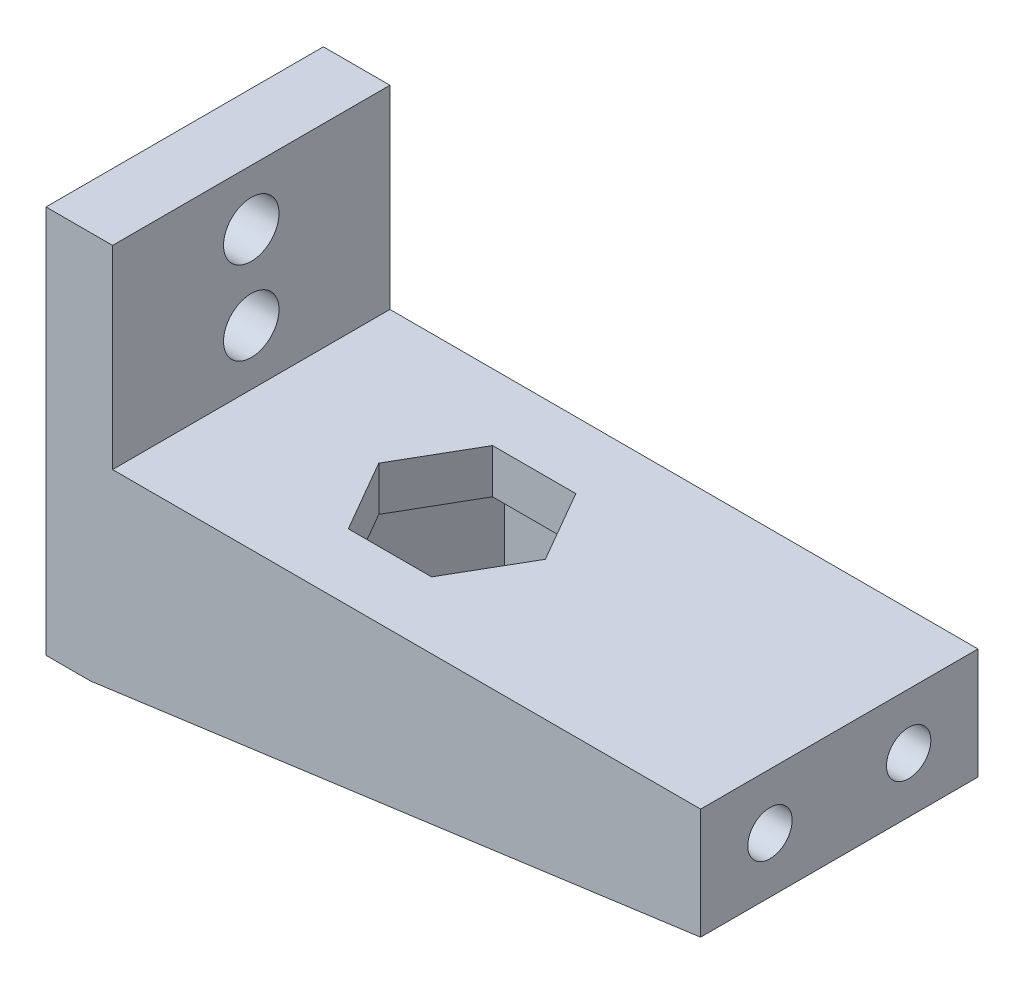
from build123d import *

# Parameters (mm, degrees)
CROQUIS3_W              = 25
CROQUIS3_H              = 35
SALIENTE_EXTRUIR2_DEPTH = 4
CROQUIS5_W              = 25
CROQUIS5_H              = 17.5
SALIENTE_EXTRUIR3_DEPTH = 2
CROQUIS7_W              = 25
CROQUIS7_H              = 10
SALIENTE_EXTRUIR5_DEPTH = 55
CROQUIS8_R              = 2.5
CORTAR_EXTRUIR1_DEPTH   = 55
SALIENTE_EXTRUIR6_DEPTH = 25
CORTAR_EXTRUIR3_DEPTH   = 4
CROQUIS11_R             = 2
CORTAR_EXTRUIR4_DEPTH   = 20
CORTAR_EXTRUIR5_DEPTH   = 45


with BuildPart() as part:
    # Croquis3 → Saliente-Extruir2 (new body)
    with BuildSketch(Plane(origin=(0, 0, 0), x_dir=(0, 0, -1), z_dir=(1, 0, 0))):
        with Locations((4.326923077, 2.8125)):
            Rectangle(CROQUIS3_W, CROQUIS3_H)
    extrude(amount=SALIENTE_EXTRUIR2_DEPTH)

    # Croquis5 → Saliente-Extruir3 (add)
    with BuildSketch(Plane(origin=(4, 0, 0), x_dir=(0, 0, -1), z_dir=(1, 0, 0))):
        with Locations((4.326923077, 11.5625)):
            Rectangle(CROQUIS5_W, CROQUIS5_H)
    extrude(amount=SALIENTE_EXTRUIR3_DEPTH)

    # Croquis7 → Saliente-Extruir5 (add)
    with BuildSketch(Plane(origin=(4, 0, 0), x_dir=(0, 0, -1), z_dir=(1, 0, 0))):
        with Locations((4.326923077, -2.1875)):
            Rectangle(CROQUIS7_W, CROQUIS7_H)
    extrude(amount=SALIENTE_EXTRUIR5_DEPTH)

    # Croquis8 → Cortar-Extruir1 (cut)
    with BuildSketch(Plane(origin=(6, 0, 0), x_dir=(0, 0, -1), z_dir=(1, 0, 0))):
        with Locations((4.326923077, 15.3125)):
            Circle(CROQUIS8_R)
        with Locations((4.326923077, 7.8125)):
            Circle(CROQUIS8_R)
    extrude(amount=-CORTAR_EXTRUIR1_DEPTH, mode=Mode.SUBTRACT)

    # Croquis10 → Saliente-Extruir6 (add, through all)
    with BuildSketch(Plane.XY.offset(8.173076923)):
        Polygon((4, -14.6875), (59, -7.1875), (4, -7.1875), align=None)
    extrude(amount=-SALIENTE_EXTRUIR6_DEPTH)

    # Croquis9 → Cortar-Extruir3 (cut)
    with BuildSketch(Plane(origin=(0, 2.8125, 0), x_dir=(1, 0, 0), z_dir=(0, 1, 0))):
        Polygon((32.505553499, 4.326923077), (28.75277675, 10.826923077), (21.24722325, 10.826923077), (17.494446501, 4.326923077), (21.24722325, -2.173076923), (28.75277675, -2.173076923), align=None)
    extrude(amount=-CORTAR_EXTRUIR3_DEPTH, mode=Mode.SUBTRACT)

    # Croquis11 → Cortar-Extruir4 (cut)
    with BuildSketch(Plane(origin=(59, 0, 0), x_dir=(0, 0, -1), z_dir=(1, 0, 0))):
        with Locations((-1.923076923, -2.1875)):
            Circle(CROQUIS11_R)
        with Locations((10.576923077, -2.1875)):
            Circle(CROQUIS11_R)
    extrude(amount=-CORTAR_EXTRUIR4_DEPTH, mode=Mode.SUBTRACT)

    # Croquis12 → Cortar-Extruir5 (cut)
    with BuildSketch(Plane(origin=(0, -1.1875, 0), x_dir=(1, 0, 0), z_dir=(0, 1, 0))):
        Polygon((30.25388745, 13.426923077), (19.74611255, 13.426923077), (14.492225101, 4.326923077), (19.74611255, -4.773076923), (30.25388745, -4.773076923), (35.507774899, 4.326923077), align=None)
    extrude(amount=-CORTAR_EXTRUIR5_DEPTH, mode=Mode.SUBTRACT)


solid = part.part
